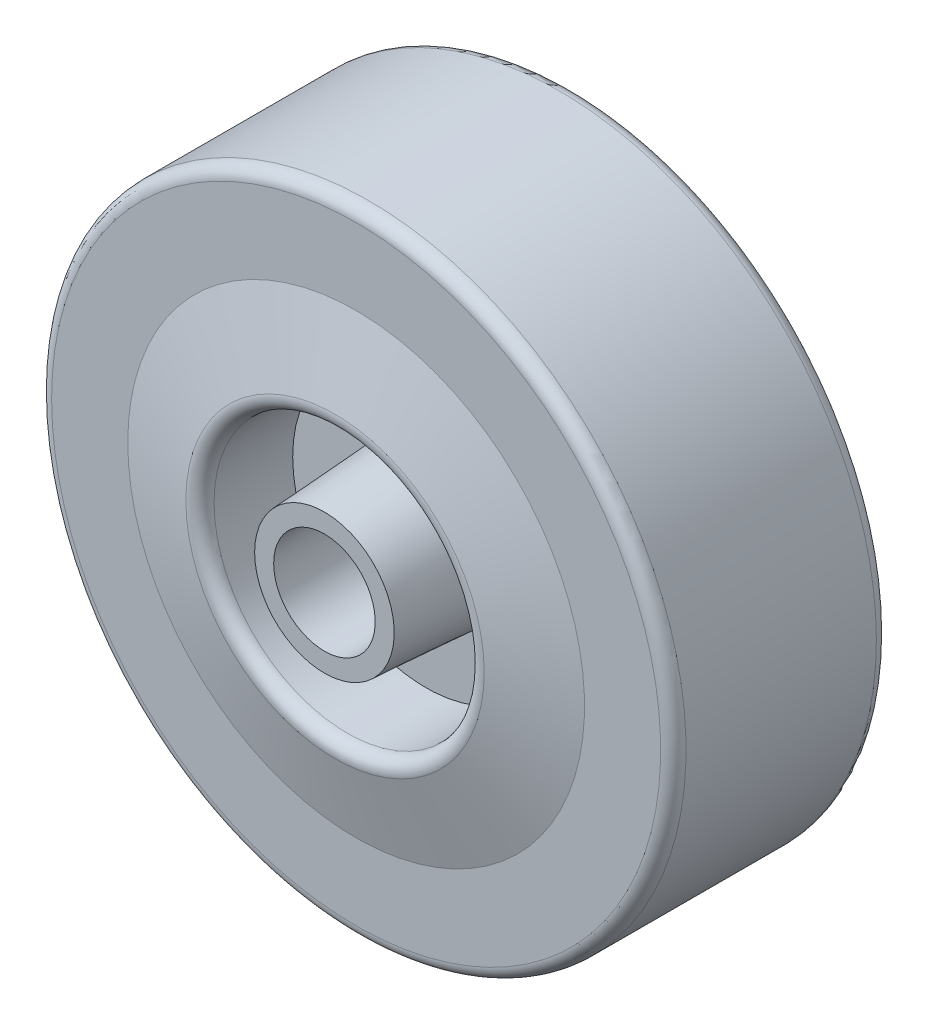
from build123d import *

# Parameters (mm, degrees)
CONG_1_R = 1
CONG_2_R = 1


with BuildPart() as part:
    # Esquisse1 → Révolution1 (revolve)
    with BuildSketch(Plane(origin=(0, 0, 0), x_dir=(1, 0, 0), z_dir=(0, 1, 0)), mode=Mode.PRIVATE) as r_volution1_sk:
        Polygon((4, -11), (4, 11), (5.5, 11), (6, 3), (10.5, 3), (10.5, 10.5), (18, 8.5), (25, 8.5), (25, -8.5), (18, -8.5), (10.5, -10.5), (10.5, -3), (6, -3), (5.5, -11), align=None)
    revolve(r_volution1_sk.sketch.rotate(Axis((0, 0, -12.605103239), (0, 0, 1)), 180), axis=Axis((0, 0, -12.605103239), (0, 0, 1)))

    # Congé1
    cong_1_edges = [part.edges().sort_by_distance(p)[0] for p in [
        (25, 0, -8.5),
        (25, 0, 8.5),
    ]]
    fillet(cong_1_edges, radius=CONG_1_R)

    # Congé2
    cong_2_edges = [part.edges().sort_by_distance(p)[0] for p in [
        (10.5, 0, -10.5),
        (10.5, 0, 10.5),
    ]]
    fillet(cong_2_edges, radius=CONG_2_R)


solid = part.part
